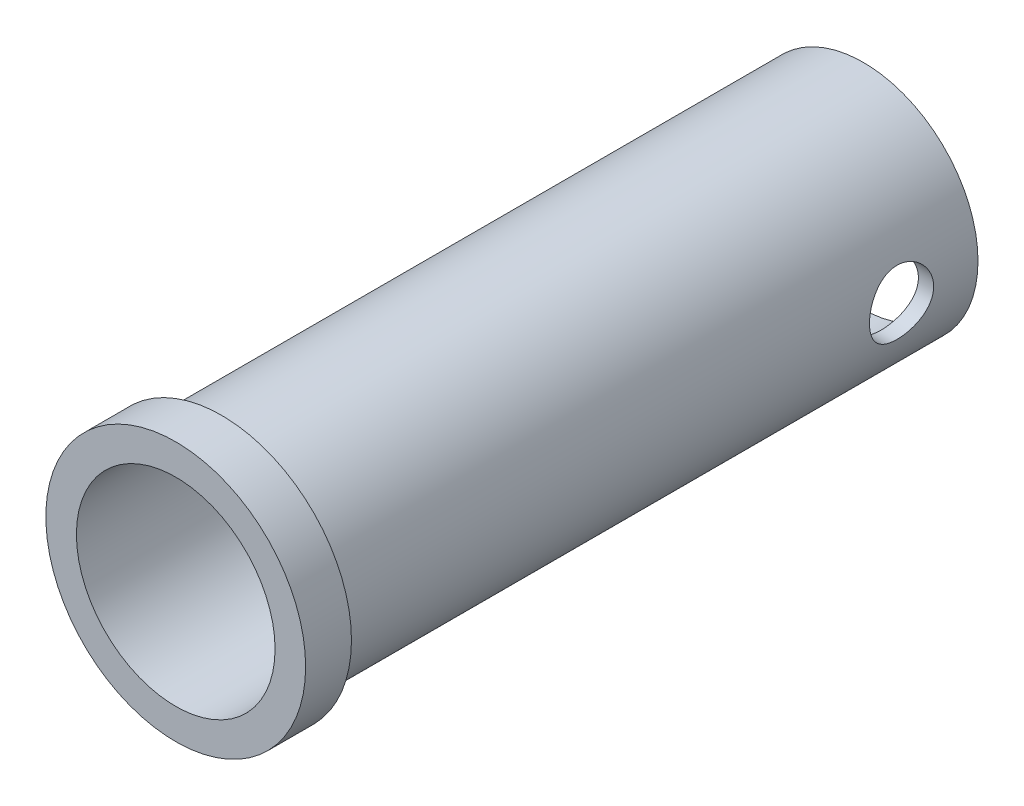
from build123d import *
from build123d.topology import SkipClean

# Parameters (mm, degrees)
ESBO_O1_R                  = 8.5
ESBO_O1_R_2                = 6.5
RESSALTO_EXTRUS_O1_DEPTH   = 3
RESSALTO_EXTRUS_O3_START   = 42
ESBO_O3_R                  = 7.5
ESBO_O3_R_2                = 6.5
RESSALTO_EXTRUS_O3_DEPTH   = 42
CORTE_EXTRUS_O1_DEPTH      = 44.686382318
CORTE_EXTRUS_O1_DEPTH_BACK = 44.686382318
ESBO_O4_R                  = 2.1


with BuildPart() as part:
    # Esboço1 → Ressalto-extrusão1 (new body)
    with BuildSketch(Plane.XY):
        Circle(ESBO_O1_R)
        Circle(ESBO_O1_R_2, mode=Mode.SUBTRACT)
    extrude(amount=RESSALTO_EXTRUS_O1_DEPTH)

    # Esboço3 → Ressalto-extrusão3 (add)
    with SkipClean():  # the faces are left unmerged after this step: merging them gives an invalid solid
        with BuildSketch(Plane(origin=(0, 0, 0), x_dir=(-1, 0, 0), z_dir=(0, 0, -1)).offset(RESSALTO_EXTRUS_O3_START)):
            with Locations(Location((0, 0, 0), (0, 0, 180))):
                Circle(ESBO_O3_R)
            Circle(ESBO_O3_R_2, mode=Mode.SUBTRACT)
        extrude(amount=-RESSALTO_EXTRUS_O3_DEPTH)

    # Esboço4 → Corte-extrusão1 (cut, two sides: drawn at the far end of the back side and taken through both)
    with SkipClean():  # the faces are left unmerged after this step: merging them gives an invalid solid
        with BuildSketch(Plane(origin=(0, 0, 0), x_dir=(0, 0, -1), z_dir=(1, 0, 0)).offset(-CORTE_EXTRUS_O1_DEPTH_BACK)):
            with Locations((37, 0)):
                Circle(ESBO_O4_R)
        extrude(amount=CORTE_EXTRUS_O1_DEPTH + CORTE_EXTRUS_O1_DEPTH_BACK, mode=Mode.SUBTRACT)


solid = part.part
